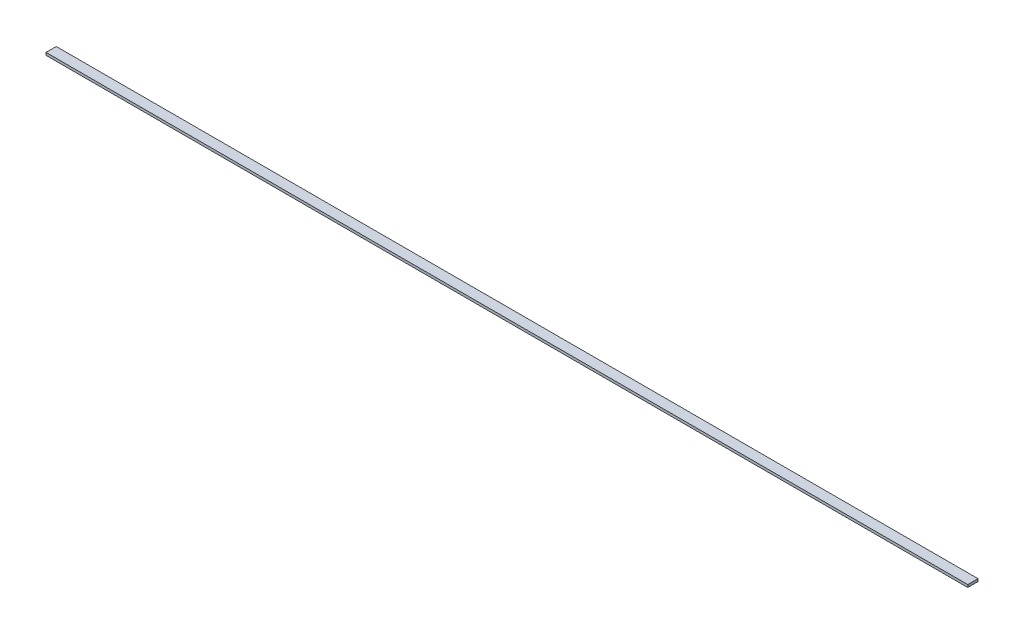
from build123d import *

# Parameters (mm, degrees)
SKETCH1_W           = 2286
SKETCH1_H           = 25.4
BOSS_EXTRUDE1_DEPTH = 6.35


with BuildPart() as part:
    # Sketch1 → Boss-Extrude1 (new body)
    with BuildSketch(Plane(origin=(0, 0, 0), x_dir=(1, 0, 0), z_dir=(0, 1, 0))):
        Rectangle(SKETCH1_W, SKETCH1_H)
    extrude(amount=BOSS_EXTRUDE1_DEPTH)


solid = part.part
